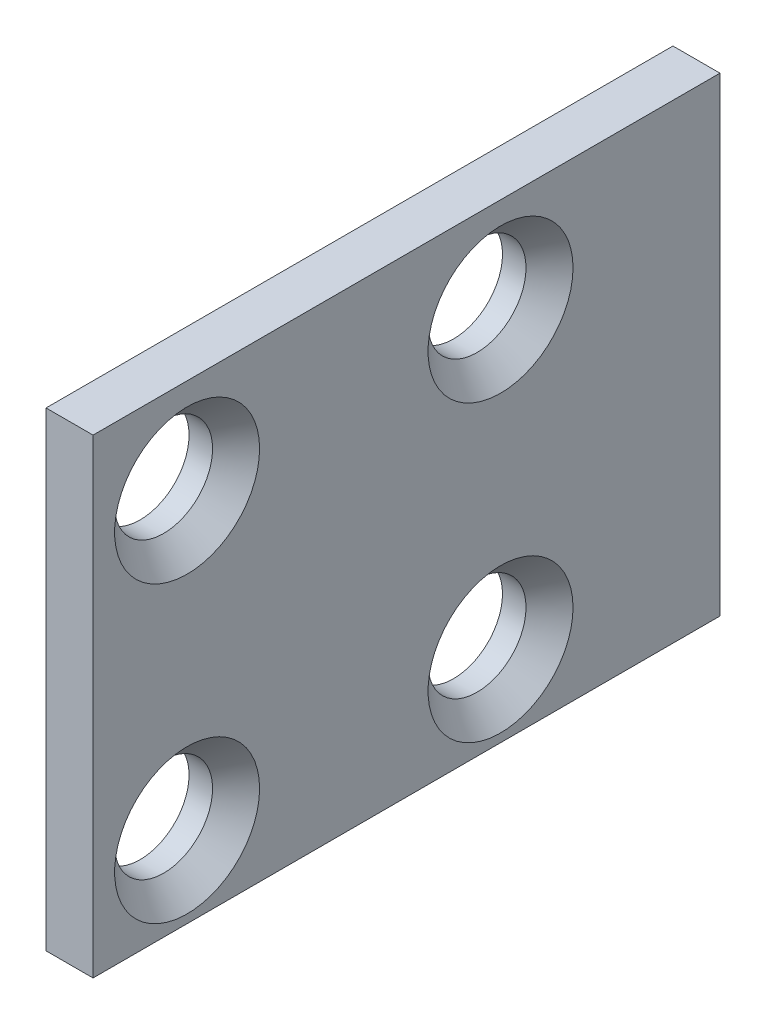
from build123d import *

# Parameters (mm, degrees)
ESBO_O1_W                = 80
ESBO_O1_H                = 60
ESBO_O1_R                = 6.25
RESSALTO_EXTRUS_O1_DEPTH = 6
CHANFRO1_SIZE            = 3


with BuildPart() as part:
    # Esboço1 → Ressalto-extrusão1 (new body)
    with BuildSketch(Plane(origin=(0, 0, 0), x_dir=(0, 0, -1), z_dir=(1, 0, 0))):
        with Locations((40, 30)):
            Rectangle(ESBO_O1_W, ESBO_O1_H)
        with Locations((12, 10.327729246)):
            Circle(ESBO_O1_R, mode=Mode.SUBTRACT)
        with Locations((12, 47.872237221)):
            Circle(ESBO_O1_R, mode=Mode.SUBTRACT)
        with Locations((52, 47.872237221)):
            Circle(ESBO_O1_R, mode=Mode.SUBTRACT)
        with Locations((52, 10.327729246)):
            Circle(ESBO_O1_R, mode=Mode.SUBTRACT)
    extrude(amount=RESSALTO_EXTRUS_O1_DEPTH)

    # Chanfro1
    chanfro1_edges = [part.edges().sort_by_distance(p)[0] for p in [
        (6, 10.327729246, -5.75),
        (6, 47.872237221, -5.75),
        (6, 47.872237221, -45.75),
        (6, 10.327729246, -45.75),
    ]]
    chamfer(chanfro1_edges, length=CHANFRO1_SIZE)


solid = part.part
